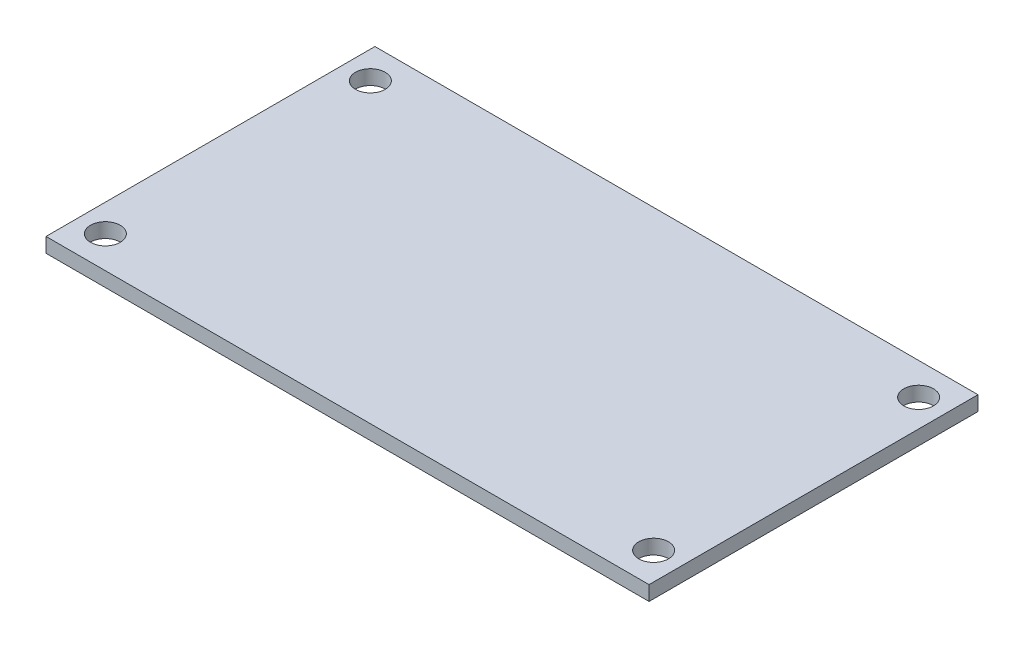
from build123d import *

# Parameters (mm, degrees)
SKETCH1_W           = 66
SKETCH1_H           = 36
SKETCH1_R           = 1.625
BOSS_EXTRUDE1_DEPTH = 1.6


with BuildPart() as part:
    # Sketch1 → Boss-Extrude1 (new body)
    with BuildSketch(Plane(origin=(0, 0, 0), x_dir=(1, 0, 0), z_dir=(0, 1, 0))):
        with Locations((33, 18)):
            Rectangle(SKETCH1_W, SKETCH1_H)
        with Locations(Location((3, 32.5, 0), (0, 0, 270))):
            Circle(SKETCH1_R, mode=Mode.SUBTRACT)
        with Locations(Location((3, 3.5, 0), (0, 0, 270))):
            Circle(SKETCH1_R, mode=Mode.SUBTRACT)
        with Locations(Location((63, 3.5, 0), (0, 0, 270))):
            Circle(SKETCH1_R, mode=Mode.SUBTRACT)
        with Locations(Location((63, 32.5, 0), (0, 0, 270))):
            Circle(SKETCH1_R, mode=Mode.SUBTRACT)
    extrude(amount=BOSS_EXTRUDE1_DEPTH)


solid = part.part
